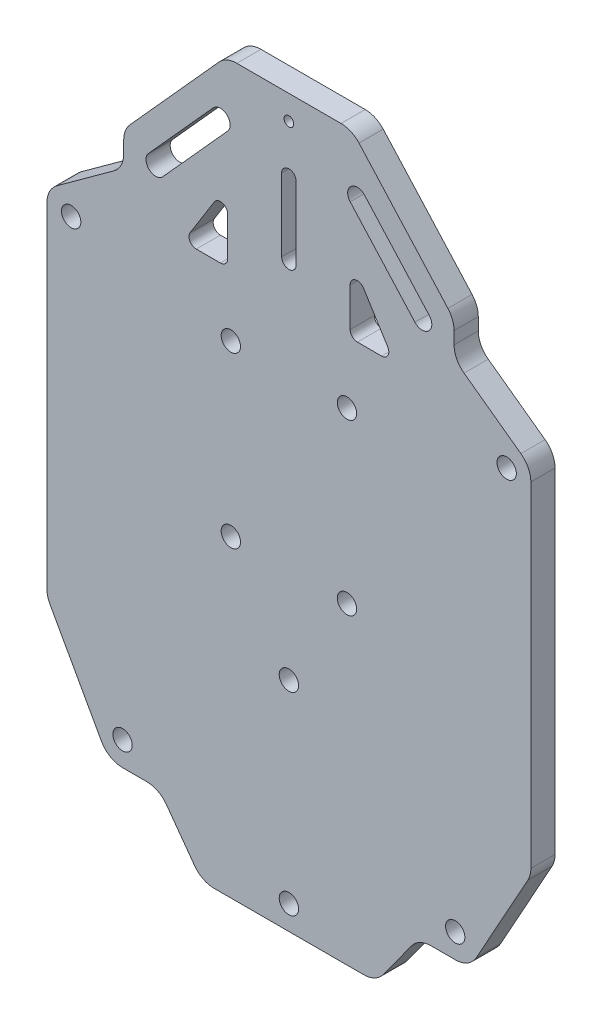
from build123d import *

# Parameters (mm, degrees)
SKETCH2_R           = 1
SKETCH2_R_2         = 2
BOSS_EXTRUDE1_DEPTH = 5


with BuildPart() as part:
    # Sketch2 → Boss-Extrude1 (new body)
    with BuildSketch(Plane.XY):
        with BuildLine():
            Line((10.773856573, 0), (-10.773856573, 0))
            ThreePointArc((-10.773856573, 0), (-12.807539789, -0.432272712), (-14.489580701, -1.654346968))
            Line((-14.489580701, -1.654346968), (-32.85230533, -22.048218747))
            ThreePointArc((-32.85230533, -22.048218747), (-33.804483335, -23.602032031), (-34.136581202, -25.393871779))
            Line((-34.136581202, -25.393871779), (-34.136581202, -27.926924356))
            ThreePointArc((-34.136581202, -27.926924356), (-34.681548581, -30.196876855), (-36.197654941, -31.972009328))
            Line((-36.197654941, -31.972009328), (-47.938926261, -40.502542276))
            ThreePointArc((-47.938926261, -40.502542276), (-49.455032621, -42.277674749), (-50, -44.547627247))
            Line((-50, -44.547627247), (-50, -113.7061014))
            ThreePointArc((-50, -113.7061014), (-49.840547901, -114.95873703), (-49.372361591, -116.131478508))
            Line((-49.372361591, -116.131478508), (-38.744938669, -135.290122192))
            ThreePointArc((-38.744938669, -135.290122192), (-36.909614174, -137.173276478), (-34.372577077, -137.864745084))
            Line((-34.372577077, -137.864745084), (-29.364406032, -137.864745084))
            ThreePointArc((-29.364406032, -137.864745084), (-27.094453533, -138.409712463), (-25.31932106, -139.925818823))
            Line((-25.31932106, -139.925818823), (-19.497457724, -147.938926261))
            ThreePointArc((-19.497457724, -147.938926261), (-17.722325251, -149.455032621), (-15.452372753, -150))
            Line((-15.452372753, -150), (15.452372753, -150))
            ThreePointArc((15.452372753, -150), (17.722325251, -149.455032621), (19.497457724, -147.938926261))
            Line((19.497457724, -147.938926261), (25.31932106, -139.925818823))
            ThreePointArc((25.31932106, -139.925818823), (27.094453533, -138.409712463), (29.364406032, -137.864745084))
            Line((29.364406032, -137.864745084), (34.372577077, -137.864745084))
            ThreePointArc((34.372577077, -137.864745084), (36.909614174, -137.173276478), (38.744938669, -135.290122192))
            Line((38.744938669, -135.290122192), (49.372361591, -116.131478508))
            ThreePointArc((49.372361591, -116.131478508), (49.840547901, -114.95873703), (50, -113.7061014))
            Line((50, -113.7061014), (50, -44.547627247))
            ThreePointArc((50, -44.547627247), (49.455032621, -42.277674749), (47.938926261, -40.502542276))
            Line((47.938926261, -40.502542276), (36.197654941, -31.972009328))
            ThreePointArc((36.197654941, -31.972009328), (34.681548581, -30.196876855), (34.136581202, -27.926924356))
            Line((34.136581202, -27.926924356), (34.136581202, -25.393871779))
            ThreePointArc((34.136581202, -25.393871779), (33.804483335, -23.602032031), (32.85230533, -22.048218747))
            Line((32.85230533, -22.048218747), (14.489580701, -1.654346968))
            ThreePointArc((14.489580701, -1.654346968), (12.807539789, -0.432272712), (10.773856573, 0))
        make_face()
        with Locations((0, -5)):
            Circle(SKETCH2_R, mode=Mode.SUBTRACT)
        with Locations((0, -145)):
            Circle(SKETCH2_R_2, mode=Mode.SUBTRACT)
        with Locations((0, -105)):
            Circle(SKETCH2_R_2, mode=Mode.SUBTRACT)
        with Locations((-12, -50.308044585)):
            Circle(SKETCH2_R_2, mode=Mode.SUBTRACT)
        with Locations((12, -50.308044585)):
            Circle(SKETCH2_R_2, mode=Mode.SUBTRACT)
        with Locations((12, -85.308044585)):
            Circle(SKETCH2_R_2, mode=Mode.SUBTRACT)
        with Locations((-12, -85.308044585)):
            Circle(SKETCH2_R_2, mode=Mode.SUBTRACT)
        with Locations((-34.372577077, -132.864745084)):
            Circle(SKETCH2_R_2, mode=Mode.SUBTRACT)
        with Locations((34.372577077, -132.864745084)):
            Circle(SKETCH2_R_2, mode=Mode.SUBTRACT)
        with Locations((-45, -44.547627247)):
            Circle(SKETCH2_R_2, mode=Mode.SUBTRACT)
        with Locations((45, -44.547627247)):
            Circle(SKETCH2_R_2, mode=Mode.SUBTRACT)
        with BuildLine():
            Line((-12.660728973, -13.073490301), (-26.043341101, -27.93638681))
            ThreePointArc((-26.043341101, -27.93638681), (-28.867891964, -28.084415248), (-29.015920402, -25.259864385))
            Line((-29.015920402, -25.259864385), (-15.633308275, -10.396967875))
            ThreePointArc((-15.633308275, -10.396967875), (-12.808757412, -10.248939437), (-12.660728973, -13.073490301))
        make_face(mode=Mode.SUBTRACT)
        with BuildLine():
            Line((14.147018624, -37.43638681), (19.147018624, -37.43638681))
            ThreePointArc((19.147018624, -37.43638681), (20.458982346, -36.663539609), (20.41901608, -35.1413884))
            Line((20.41901608, -35.1413884), (15.41901608, -27.1413884))
            ThreePointArc((15.41901608, -27.1413884), (13.733494855, -26.494513691), (12.647018624, -27.93638681))
            Line((12.647018624, -27.93638681), (12.647018624, -35.93638681))
            ThreePointArc((12.647018624, -35.93638681), (13.086358453, -36.997046982), (14.147018624, -37.43638681))
        make_face(mode=Mode.SUBTRACT)
        with BuildLine():
            Line((-14.147018624, -37.43638681), (-19.147018624, -37.43638681))
            ThreePointArc((-19.147018624, -37.43638681), (-20.458982346, -36.663539609), (-20.41901608, -35.1413884))
            Line((-20.41901608, -35.1413884), (-15.41901608, -27.1413884))
            ThreePointArc((-15.41901608, -27.1413884), (-13.733494855, -26.494513691), (-12.647018624, -27.93638681))
            Line((-12.647018624, -27.93638681), (-12.647018624, -35.93638681))
            ThreePointArc((-12.647018624, -35.93638681), (-13.086358453, -36.997046982), (-14.147018624, -37.43638681))
        make_face(mode=Mode.SUBTRACT)
        with BuildLine():
            Line((12.660728973, -13.073490301), (26.043341101, -27.93638681))
            ThreePointArc((26.043341101, -27.93638681), (28.867891964, -28.084415248), (29.015920402, -25.259864385))
            Line((29.015920402, -25.259864385), (15.633308275, -10.396967875))
            ThreePointArc((15.633308275, -10.396967875), (12.808757412, -10.248939437), (12.660728973, -13.073490301))
        make_face(mode=Mode.SUBTRACT)
        with BuildLine():
            Line((1.5, -15), (1.5, -30))
            ThreePointArc((1.5, -30), (0, -31.5), (-1.5, -30))
            Line((-1.5, -30), (-1.5, -15))
            ThreePointArc((-1.5, -15), (0, -13.5), (1.5, -15))
        make_face(mode=Mode.SUBTRACT)
    extrude(amount=BOSS_EXTRUDE1_DEPTH)


solid = part.part
